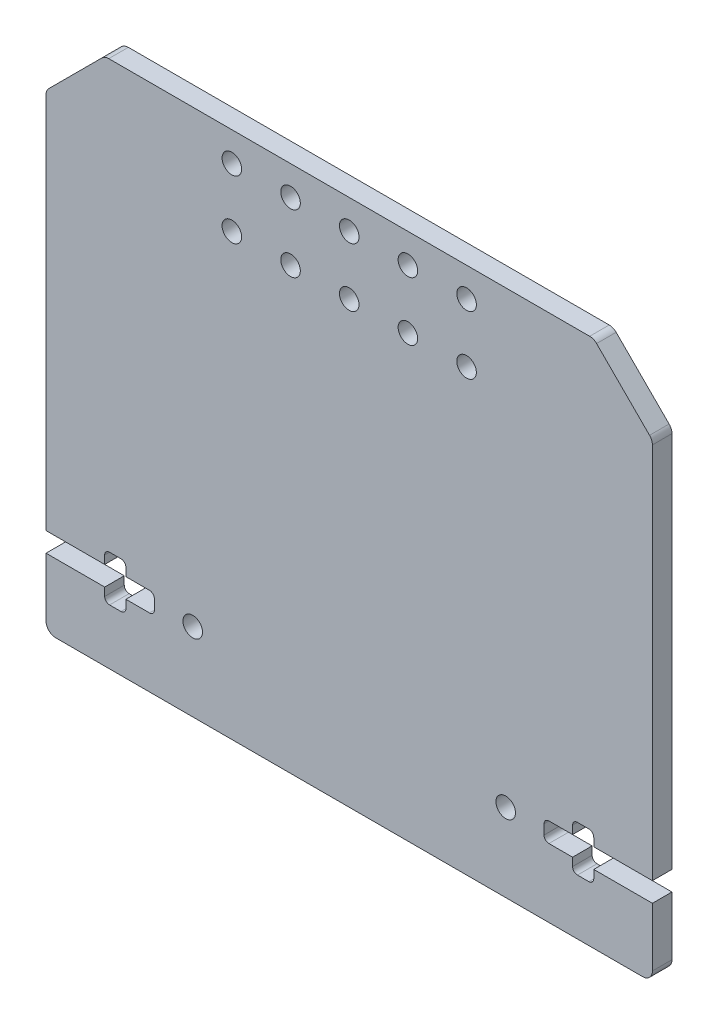
from build123d import *

# Parameters (mm, degrees)
MODEL_R                 = 1.5
SALIENTE_EXTRUIR1_DEPTH = 3


with BuildPart() as part:
    # Model → Saliente-Extruir1 (new body)
    with BuildSketch(Plane.XY):
        with BuildLine():
            Line((-1396.348255289, 396.908179756), (-1470.105614602, 396.908179756))
            ThreePointArc((-1470.105614602, 396.908179756), (-1470.679639751, 396.793999055), (-1471.166274774, 396.468839928))
            Line((-1471.166274774, 396.468839928), (-1479.287595118, 388.347519585))
            ThreePointArc((-1479.287595118, 388.347519585), (-1479.612754245, 387.860884562), (-1479.726934946, 387.286859413))
            Line((-1479.726934946, 387.286859413), (-1479.726934946, 329.408179756))
            Line((-1479.726934946, 329.408179756), (-1470.731934946, 329.408179756))
            Line((-1470.731934946, 329.408179756), (-1470.731934946, 330.658179756))
            ThreePointArc((-1470.731934946, 330.658179756), (-1470.512265032, 331.188509842), (-1469.981934946, 331.408179756))
            Line((-1469.981934946, 331.408179756), (-1468.231934946, 331.408179756))
            ThreePointArc((-1468.231934946, 331.408179756), (-1467.70160486, 331.188509842), (-1467.481934946, 330.658179756))
            Line((-1467.481934946, 330.658179756), (-1467.481934946, 329.408179756))
            Line((-1467.481934946, 329.408179756), (-1463.856934946, 329.408179756))
            ThreePointArc((-1463.856934946, 329.408179756), (-1463.32660486, 329.188509842), (-1463.106934946, 328.658179756))
            Line((-1463.106934946, 328.658179756), (-1463.106934946, 327.158179756))
            ThreePointArc((-1463.106934946, 327.158179756), (-1463.32660486, 326.627849671), (-1463.856934946, 326.408179756))
            Line((-1463.856934946, 326.408179756), (-1467.481934946, 326.408179756))
            Line((-1467.481934946, 326.408179756), (-1467.481934946, 325.158179756))
            ThreePointArc((-1467.481934946, 325.158179756), (-1467.70160486, 324.627849671), (-1468.231934946, 324.408179756))
            Line((-1468.231934946, 324.408179756), (-1469.981934946, 324.408179756))
            ThreePointArc((-1469.981934946, 324.408179756), (-1470.512265032, 324.627849671), (-1470.731934946, 325.158179756))
            Line((-1470.731934946, 325.158179756), (-1470.731934946, 326.408179756))
            Line((-1470.731934946, 326.408179756), (-1479.726934946, 326.408179756))
            Line((-1479.726934946, 326.408179756), (-1479.726934946, 317.408179756))
            ThreePointArc((-1479.726934946, 317.408179756), (-1479.287595118, 316.347519585), (-1478.226934946, 315.908179756))
            Line((-1478.226934946, 315.908179756), (-1388.226934946, 315.908179756))
            ThreePointArc((-1388.226934946, 315.908179756), (-1387.166274774, 316.347519585), (-1386.726934946, 317.408179756))
            Line((-1386.726934946, 317.408179756), (-1386.726934946, 326.408179756))
            Line((-1386.726934946, 326.408179756), (-1395.721934946, 326.408179756))
            Line((-1395.721934946, 326.408179756), (-1395.721934946, 325.158179756))
            ThreePointArc((-1395.721934946, 325.158179756), (-1395.94160486, 324.627849671), (-1396.471934946, 324.408179756))
            Line((-1396.471934946, 324.408179756), (-1398.221934946, 324.408179756))
            ThreePointArc((-1398.221934946, 324.408179756), (-1398.752265032, 324.627849671), (-1398.971934946, 325.158179756))
            Line((-1398.971934946, 325.158179756), (-1398.971934946, 326.408179756))
            Line((-1398.971934946, 326.408179756), (-1402.596934946, 326.408179756))
            ThreePointArc((-1402.596934946, 326.408179756), (-1403.127265032, 326.627849671), (-1403.346934946, 327.158179756))
            Line((-1403.346934946, 327.158179756), (-1403.346934946, 328.658179756))
            ThreePointArc((-1403.346934946, 328.658179756), (-1403.127265032, 329.188509842), (-1402.596934946, 329.408179756))
            Line((-1402.596934946, 329.408179756), (-1398.971934946, 329.408179756))
            Line((-1398.971934946, 329.408179756), (-1398.971934946, 330.658179756))
            ThreePointArc((-1398.971934946, 330.658179756), (-1398.752265032, 331.188509842), (-1398.221934946, 331.408179756))
            Line((-1398.221934946, 331.408179756), (-1396.471934946, 331.408179756))
            ThreePointArc((-1396.471934946, 331.408179756), (-1395.94160486, 331.188509842), (-1395.721934946, 330.658179756))
            Line((-1395.721934946, 330.658179756), (-1395.721934946, 329.408179756))
            Line((-1395.721934946, 329.408179756), (-1386.726934946, 329.408179756))
            Line((-1386.726934946, 329.408179756), (-1386.726934946, 387.286859413))
            ThreePointArc((-1386.726934946, 387.286859413), (-1386.841115647, 387.860884562), (-1387.166274774, 388.347519585))
            Line((-1387.166274774, 388.347519585), (-1395.287595118, 396.468839928))
            ThreePointArc((-1395.287595118, 396.468839928), (-1395.774230141, 396.793999055), (-1396.348255289, 396.908179756))
        make_face()
        with Locations((-1433.226934946, 392.408179756)):
            Circle(MODEL_R, mode=Mode.SUBTRACT)
        with Locations((-1451.226934946, 392.408179756)):
            Circle(MODEL_R, mode=Mode.SUBTRACT)
        with Locations((-1442.226934946, 392.408179756)):
            Circle(MODEL_R, mode=Mode.SUBTRACT)
        with Locations((-1442.226934946, 383.408179756)):
            Circle(MODEL_R, mode=Mode.SUBTRACT)
        with Locations((-1433.226934946, 383.408179756)):
            Circle(MODEL_R, mode=Mode.SUBTRACT)
        with Locations((-1451.226934946, 383.408179756)):
            Circle(MODEL_R, mode=Mode.SUBTRACT)
        with Locations((-1424.226934946, 392.408179756)):
            Circle(MODEL_R, mode=Mode.SUBTRACT)
        with Locations((-1415.226934946, 392.408179756)):
            Circle(MODEL_R, mode=Mode.SUBTRACT)
        with Locations((-1424.226934946, 383.408179756)):
            Circle(MODEL_R, mode=Mode.SUBTRACT)
        with Locations((-1457.226934946, 327.908179756)):
            Circle(MODEL_R, mode=Mode.SUBTRACT)
        with Locations((-1409.226934946, 327.908179756)):
            Circle(MODEL_R, mode=Mode.SUBTRACT)
        with Locations((-1415.226934946, 383.408179756)):
            Circle(MODEL_R, mode=Mode.SUBTRACT)
    extrude(amount=SALIENTE_EXTRUIR1_DEPTH)


solid = part.part
